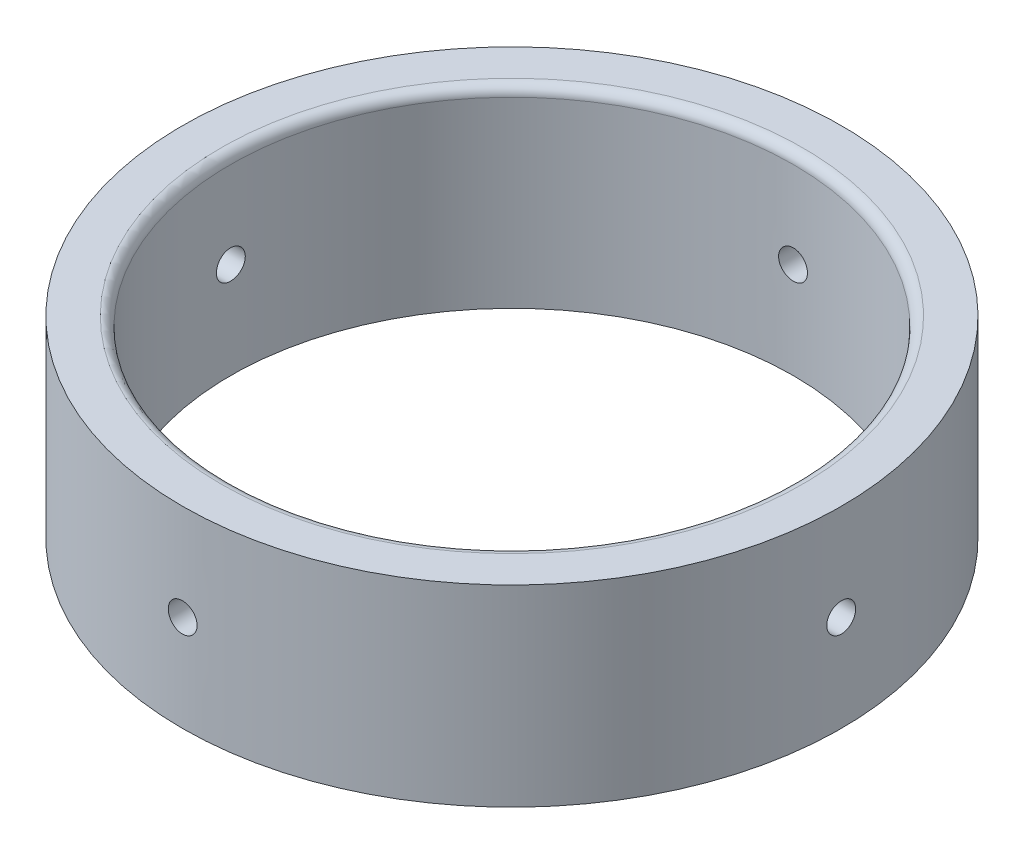
from build123d import *

# Parameters (mm, degrees)
SKETCH1_R           = 34.25
SKETCH1_R_2         = 29.25
BOSS_EXTRUDE1_DEPTH = 20
SKETCH2_R           = 1.5
CUT_EXTRUDE1_DEPTH  = 20
CIRPATTERN1_COUNT   = 4
FILLET1_R           = 1


with BuildPart() as part:
    # Sketch1 → Boss-Extrude1 (new body)
    with BuildSketch(Plane(origin=(0, 0, 0), x_dir=(1, 0, 0), z_dir=(0, 1, 0))):
        with Locations(Location((0, 0, 0), (0, 0, 270))):
            Circle(SKETCH1_R)
        with Locations(Location((0, 0, 0), (0, 0, 270))):
            Circle(SKETCH1_R_2, mode=Mode.SUBTRACT)
    extrude(amount=BOSS_EXTRUDE1_DEPTH)

    # Sketch2 → Cut-Extrude1 (cut)
    with BuildSketch(Plane.ZY.offset(34.25)):
        with Locations((0, 10)):
            Circle(SKETCH2_R)
    cut_extrude1 = extrude(amount=-CUT_EXTRUDE1_DEPTH, mode=Mode.SUBTRACT)

    # CirPattern1: Cut-Extrude1 ×4 about axis
    cirpattern1_axis = Axis((0, 20, 0), (0, -1, 0))
    for i in range(1, CIRPATTERN1_COUNT):
        add(cut_extrude1.rotate(cirpattern1_axis, i * 360 / CIRPATTERN1_COUNT), mode=Mode.SUBTRACT)

    # Fillet1
    fillet1_edges = [part.edges().sort_by_distance(p)[0] for p in [
        (0, 20, -29.25),
    ]]
    fillet(fillet1_edges, radius=FILLET1_R)


solid = part.part
